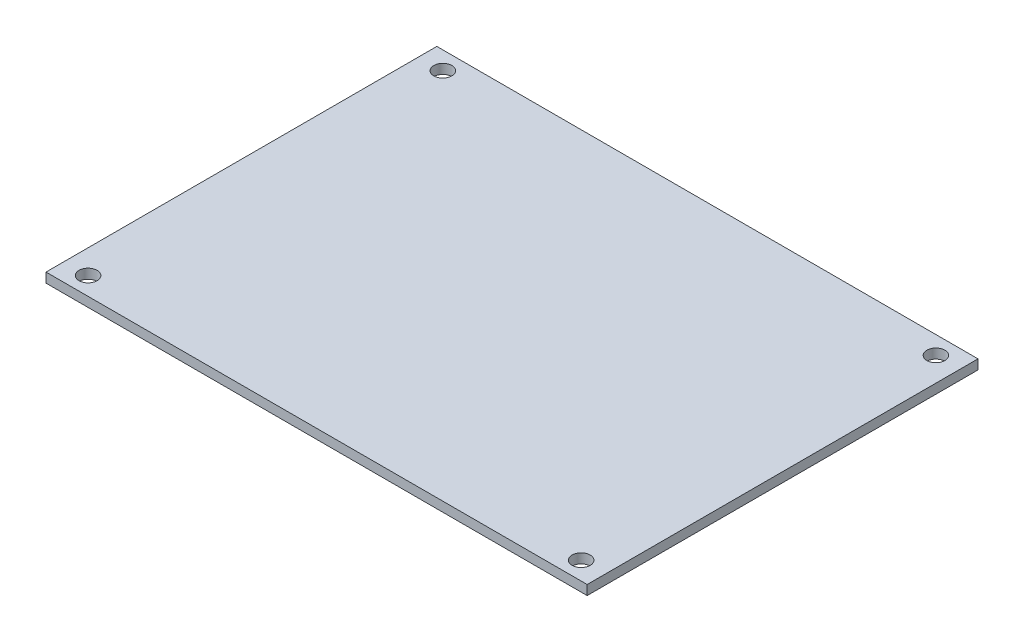
from build123d import *

# Parameters (mm, degrees)
SKETCH1_W           = 90
SKETCH1_H           = 65
SKETCH1_R           = 1.5
BOSS_EXTRUDE1_DEPTH = 1.6


with BuildPart() as part:
    # Sketch1 → Boss-Extrude1 (new body)
    with BuildSketch(Plane(origin=(0, 0, 0), x_dir=(1, 0, 0), z_dir=(0, 1, 0))):
        with Locations((45, 32.5)):
            Rectangle(SKETCH1_W, SKETCH1_H)
        with Locations(Location((4, 3, 0), (0, 0, 270))):
            Circle(SKETCH1_R, mode=Mode.SUBTRACT)
        with Locations(Location((86, 3, 0), (0, 0, 270))):
            Circle(SKETCH1_R, mode=Mode.SUBTRACT)
        with Locations(Location((4, 62, 0), (0, 0, 270))):
            Circle(SKETCH1_R, mode=Mode.SUBTRACT)
        with Locations(Location((86, 62, 0), (0, 0, 270))):
            Circle(SKETCH1_R, mode=Mode.SUBTRACT)
    extrude(amount=BOSS_EXTRUDE1_DEPTH)


solid = part.part
